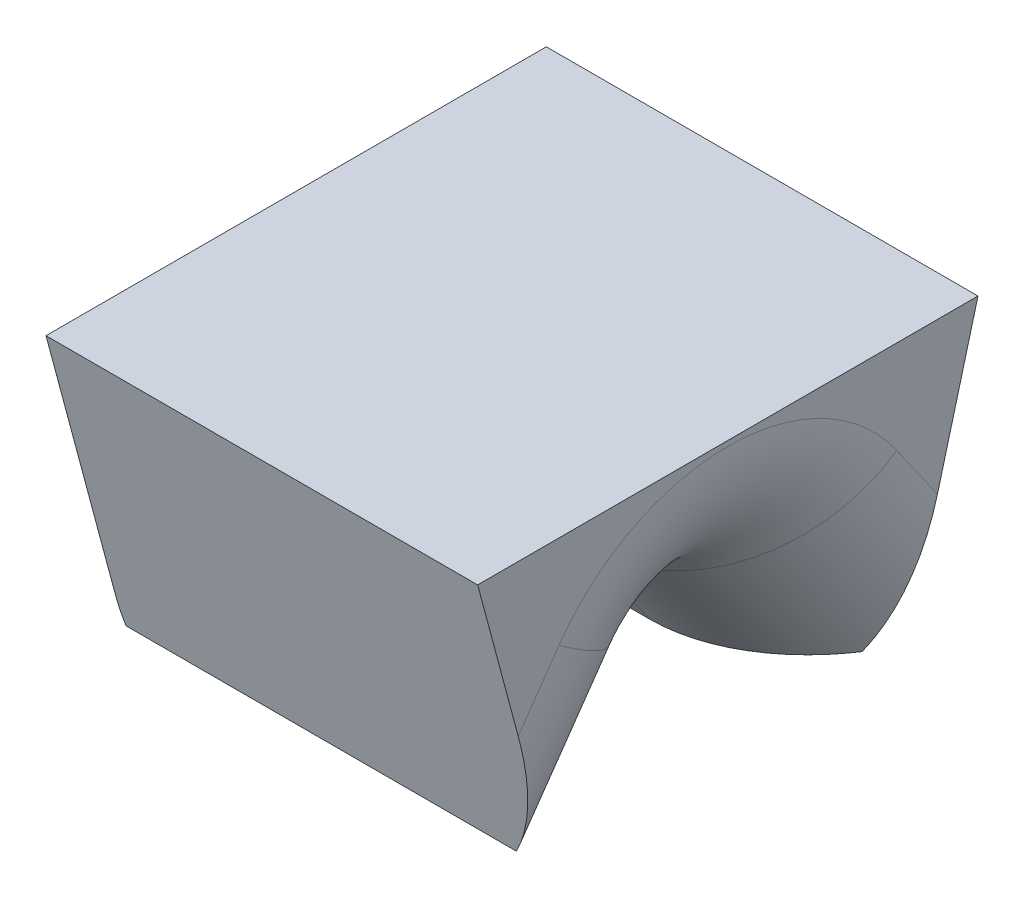
from build123d import *

# Parameters (mm, degrees)
SKETCH_TL_CUTTING_R    = 1.99771
TL_CUTTING_DEPTH       = 29.999999944
SKETCH_TDF_CUTTING_W   = 4.01541996
SKETCH_TDF_CUTTING_H   = 4.01541996
TDF_CUTTING_DEPTH      = 31.132734478
VW_VR_GRINDING_DEPTH   = 2.00770998
VW_VR_GRINDING_2_DEPTH = 2.00770998
ISA_GRINDING_DEPTH     = 2.00770998
SKETCH_PRE_FRX_BRX_W   = 0.93996002
SKETCH_PRE_FRX_BRX_H   = 1.6256
SKETCH_PRE_FRX_BRX_W_2 = 1.81577996
PRE_FRX_BRX_DEPTH      = 2.00770998
FA_BA_GRINDING_DEPTH   = 2.00770998
BR_EDM_R               = 0.24892
FR_EDM_R               = 0.50038


with BuildPart() as part:
    # sketch_TL_cutting → TL_cutting (new body)
    with BuildSketch(Plane(origin=(0, 0, 0), x_dir=(1, 0, 0), z_dir=(0, 1, 0))):
        with Locations(Location((0, 0, 0), (0, 0, 270))):
            Circle(SKETCH_TL_CUTTING_R)
    extrude(amount=TL_CUTTING_DEPTH)

    # sketch_TDF_cutting → TDF_cutting (cut, through all)
    with BuildSketch(Plane(origin=(0, 0, 0), x_dir=(1, 0, 0), z_dir=(0, 1, 0))):
        with Locations((-3.60917998, 0)):
            Rectangle(SKETCH_TDF_CUTTING_W, SKETCH_TDF_CUTTING_H)
    extrude(amount=TDF_CUTTING_DEPTH, mode=Mode.SUBTRACT)


with BuildPart() as body_2:
    # sketch_VW_VR_grinding → VW_VR_grinding (new, symmetric)
    with BuildSketch(Plane(origin=(0, 0, 0), x_dir=(0, 0, -1), z_dir=(1, 0, 0))):
        with BuildLine():
            Line((-1.59004, -0.00999998), (-1.59004, 9.985377879))
            ThreePointArc((-1.59004, 9.985377879), (-1.591006547, 10.007515438), (-1.593898831, 10.029484517))
            Line((-1.593898831, 10.029484517), (-2.01770996, 12.433036869))
            Line((-2.01770996, 12.433036869), (-2.00770998, -0.00999998))
            Line((-2.00770998, -0.00999998), (-1.59004, -0.00999998))
        make_face()
    extrude(amount=VW_VR_GRINDING_DEPTH, both=True)


with BuildPart() as body_3:
    # sketch_VW_VR_grinding → VW_VR_grinding 2 (new, symmetric)
    with BuildSketch(Plane(origin=(0, 0, 0), x_dir=(0, 0, -1), z_dir=(1, 0, 0))):
        with BuildLine():
            Line((1.59004, -0.00999998), (1.59004, 9.985377879))
            ThreePointArc((1.59004, 9.985377879), (1.591006547, 10.007515438), (1.593898831, 10.029484517))
            Line((1.593898831, 10.029484517), (2.01770996, 12.433036869))
            Line((2.01770996, 12.433036869), (2.00770998, -0.00999998))
            Line((2.00770998, -0.00999998), (1.59004, -0.00999998))
        make_face()
    extrude(amount=VW_VR_GRINDING_2_DEPTH, both=True)


    add(body_2.part)  # ISA_grinding merges body 2
    # sketch_ISA_grinding → ISA_grinding (add, symmetric)
    with BuildSketch(Plane(origin=(0, 0, 0), x_dir=(0, 0, -1), z_dir=(1, 0, 0))):
        Polygon((-0.50038, 0), (0.50038, 0), (2.00770998, 5.625432069), (2.00770998, -0.02999994), (-2.00770998, -0.02999994), (-2.00770998, 5.625432069), align=None)
    extrude(amount=ISA_GRINDING_DEPTH, both=True)

    # sketch_pre_FRX_BRX → pre_FRX_BRX (add, symmetric)
    with BuildSketch(Plane.XY):
        with Locations((1.52772999, 0.80280002)):
            Rectangle(SKETCH_PRE_FRX_BRX_W, SKETCH_PRE_FRX_BRX_H)
        with Locations((-1.10981998, 0.80280002)):
            Rectangle(SKETCH_PRE_FRX_BRX_W_2, SKETCH_PRE_FRX_BRX_H)
    extrude(amount=PRE_FRX_BRX_DEPTH, both=True)

    # sketch_FA_BA_grinding → FA_BA_grinding (add, symmetric)
    with BuildSketch(Plane.XY):
        Polygon((1.04775, -0.00999998), (1.04775, 1.6256), (2.12471, 9.288568576), (2.12471, -0.00999998), align=None)
        Polygon((-0.20193, -0.00999998), (-0.20193, 1.6256), (-1.72847, 12.487496496), (-1.72847, -0.00999998), align=None)
    extrude(amount=FA_BA_GRINDING_DEPTH, both=True)


with BuildPart() as part_1:
    add(part.part)

    # B1_fix: cut body 3
    add(body_3.part, mode=Mode.SUBTRACT)

    # V-Groove_EDM: sweep along a path in sketch_contour_V-Groove
    with BuildLine(Plane.XY) as v_groove_edm_path:
        Line((-1.60147, 0.32004), (1.99771, 0.32004))
    # sketch_section_V-Groove → V-Groove_EDM (sweep, cut)
    with BuildSketch(Plane(origin=(-1.60147, 0, -1.2954), x_dir=(0, 0, -1), z_dir=(1, 0, 0))):
        with BuildLine():
            Line((-1.216335445, 0.278881598), (-1.014058386, -0.00999998))
            Line((-1.014058386, -0.00999998), (-1.576741614, -0.00999998))
            Line((-1.576741614, -0.00999998), (-1.374464555, 0.278881598))
            ThreePointArc((-1.374464555, 0.278881598), (-1.2954, 0.32004), (-1.216335445, 0.278881598))
        make_face()
    sweep(path=v_groove_edm_path.line, mode=Mode.SUBTRACT)

    # BR_EDM
    br_edm_edges = [part_1.edges().sort_by_distance(p)[0] for p in [
        (-0.20193, 0.32004, 0),
        (-0.20193, 0.139440799, -0.176702054),
        (-0.20193, 0.139440799, 0.176702054),
    ]]
    fillet(br_edm_edges, radius=BR_EDM_R)

    # FR_EDM
    fr_edm_edges = [part_1.edges().sort_by_distance(p)[0] for p in [
        (1.04775, 0.139440799, -0.176702054),
        (1.04775, 0.139440799, 0.176702054),
        (1.04775, 0.32004, 0),
    ]]
    fillet(fr_edm_edges, radius=FR_EDM_R)

    # SurfaceCut1
    split(bisect_by=Plane(origin=(0, 0.835526316, 0), x_dir=(1, 0, 0), z_dir=(0, 1, 0)), keep=Keep.BOTTOM)


solid = part_1.part
